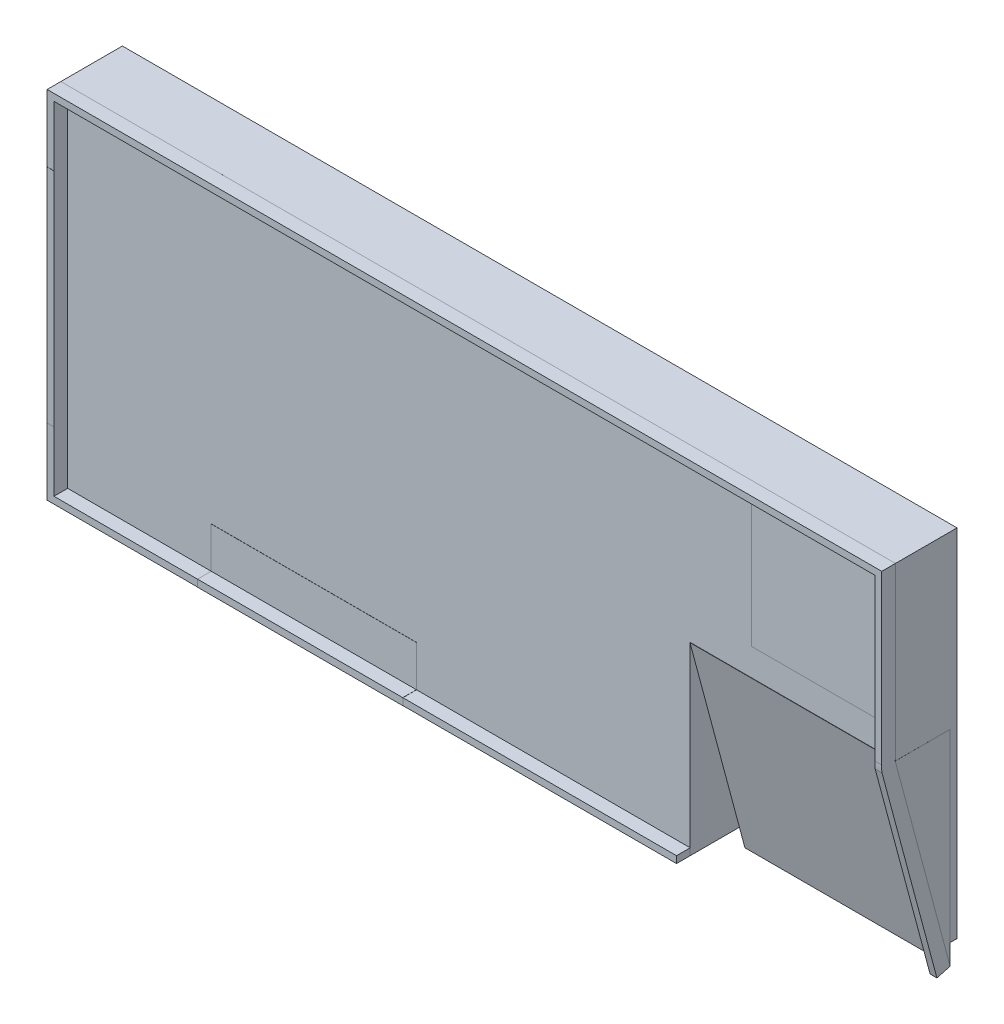
from build123d import *

# Parameters (mm, degrees)
SKETCH1_W            = 6100
SKETCH1_H            = 2600
BOSS_EXTRUDE1_DEPTH  = 450
SKETCH4_W            = 400
SKETCH4_H            = 1350
CUT_EXTRUDE1_DEPTH   = 1500
BOSS_EXTRUDE3_DEPTH  = 1500
SKETCH6_W            = 50
SKETCH6_H            = 1552.417027542
BOSS_EXTRUDE4_DEPTH  = 100
BOSS_EXTRUDE5_DEPTH  = 100
SKETCH8_W            = 1000
SKETCH8_H            = 1000
BOSS_EXTRUDE6_DEPTH  = 1
SKETCH9_W            = 1500
SKETCH9_H            = 300
BOSS_EXTRUDE7_DEPTH  = 1
SKETCH11_W           = 50
SKETCH11_H           = 1620
BOSS_EXTRUDE8_DEPTH  = 1
BOSS_EXTRUDE9_DEPTH  = 50
SKETCH13_W           = 1500
SKETCH13_H           = 100
BOSS_EXTRUDE10_DEPTH = 1
SKETCH14_W           = 1500
SKETCH14_H           = 50
BOSS_EXTRUDE11_DEPTH = 1


with BuildPart() as part:
    # Sketch1 → Boss-Extrude1 (new body)
    with BuildSketch(Plane.XY):
        with Locations((737.396460488, 236.627579872)):
            Rectangle(SKETCH1_W, SKETCH1_H)
    extrude(amount=BOSS_EXTRUDE1_DEPTH)

    # Sketch4 → Cut-Extrude1 (cut)
    with BuildSketch(Plane(origin=(3787.396460488, 0, 0), x_dir=(0, 0, -1), z_dir=(1, 0, 0))):
        with Locations((-250, -388.372420128)):
            Rectangle(SKETCH4_W, SKETCH4_H)
    extrude(amount=-CUT_EXTRUDE1_DEPTH, mode=Mode.SUBTRACT)

    # Sketch5 → Boss-Extrude3 (add)
    with BuildSketch(Plane(origin=(3787.396460488, 0, 0), x_dir=(0, 0, -1), z_dir=(1, 0, 0))):
        Polygon((-451.795187023, 286.147509687), (-50.000025773, 286.627553668), (-50.000025773, -1213.372446332), align=None)
    extrude(amount=-BOSS_EXTRUDE3_DEPTH)

    # Sketch6 → Boss-Extrude4 (add)
    with BuildSketch(Plane(origin=(0, -93.780548221, 349.993770724), x_dir=(1, 0, 0), z_dir=(0, -0.2588190451025147, 0.96592582628907))):
        with Locations((3762.395460488, -382.87836543)):
            Rectangle(SKETCH6_W, SKETCH6_H)
    extrude(amount=BOSS_EXTRUDE4_DEPTH)

    # Sketch7 → Boss-Extrude5 (add)
    with BuildSketch(Plane.XY.offset(450)):
        Polygon((3787.395460488, 309.532556673), (3787.395460488, 1536.626579872), (-2312.602539512, 1536.626579872), (-2312.602539512, -1063.371420128), (2287.395460488, -1063.371420128), (2287.395460488, -1013.371420128), (-2262.602539512, -1013.371420128), (-2262.602539512, 1486.626579872), (3737.395460488, 1486.626579872), (3737.395460488, 309.532556673), align=None)
    extrude(amount=BOSS_EXTRUDE5_DEPTH)

    # Sketch8 → Boss-Extrude6 (add)
    with BuildSketch(Plane.XY.offset(450)):
        with Locations((3237.394460488, 986.625579872)):
            Rectangle(SKETCH8_W, SKETCH8_H)
    extrude(amount=BOSS_EXTRUDE6_DEPTH)

    # Sketch9 → Boss-Extrude7 (add)
    with BuildSketch(Plane.XY.offset(450)):
        with Locations((-462.603539512, -863.370420128)):
            Rectangle(SKETCH9_W, SKETCH9_H)
    extrude(amount=BOSS_EXTRUDE7_DEPTH)

    # Sketch11 → Boss-Extrude8 (add)
    with BuildSketch(Plane.XY.offset(550)):
        with Locations((-2287.602539512, 236.628579872)):
            Rectangle(SKETCH11_W, SKETCH11_H)
    extrude(amount=BOSS_EXTRUDE8_DEPTH)

    # Sketch12 → Boss-Extrude9 (add)
    with BuildSketch(Plane(origin=(3787.395460488, 0, 0), x_dir=(0, 0, -1), z_dir=(1, 0, 0))):
        with BuildLine():
            Line((-550, 309.532556673), (-450, 309.532556673))
            Line((-450, 309.532556673), (-451.795104128, 286.14720032))
            Line((-451.795104128, 286.14720032), (-548.387686757, 260.265295809))
            ThreePointArc((-548.387686757, 260.265295809), (-550.614930996, 284.852419934), (-550, 309.532556673))
        make_face()
    extrude(amount=-BOSS_EXTRUDE9_DEPTH)

    # Sketch13 → Boss-Extrude10 (add)
    with BuildSketch(Plane(origin=(0, -1013.371420128, 0), x_dir=(1, 0, 0), z_dir=(0, 1, 0))):
        with Locations((-462.603539512, -501)):
            Rectangle(SKETCH13_W, SKETCH13_H)
    extrude(amount=BOSS_EXTRUDE10_DEPTH)

    # Sketch14 → Boss-Extrude11 (add)
    with BuildSketch(Plane.XY.offset(550)):
        with Locations((-461.248387127, -1038.371420128)):
            Rectangle(SKETCH14_W, SKETCH14_H)
    extrude(amount=BOSS_EXTRUDE11_DEPTH)


solid = part.part
